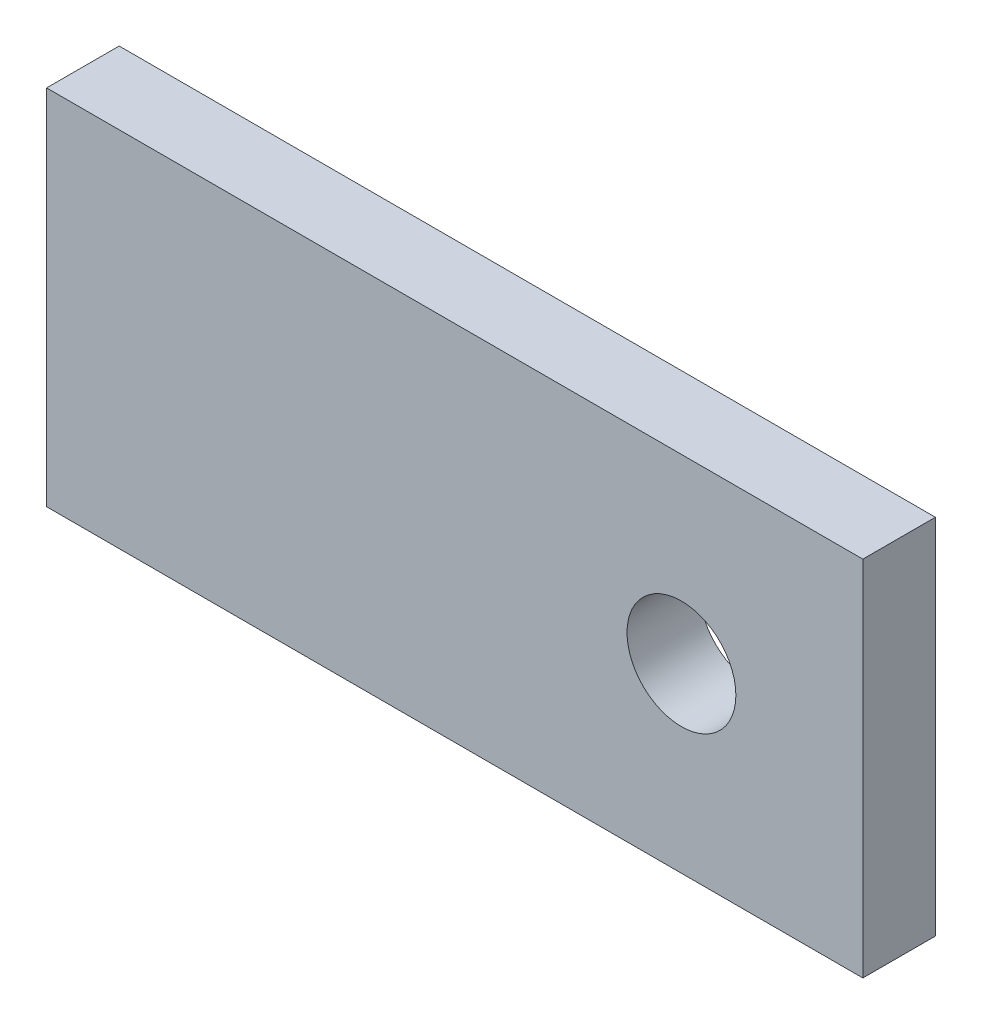
from build123d import *

# Parameters (mm, degrees)
SKETCH1_W           = 90
SKETCH1_H           = 40
SKETCH1_R           = 6
BOSS_EXTRUDE1_DEPTH = 8


with BuildPart() as part:
    # Sketch1 → Boss-Extrude1 (new body)
    with BuildSketch(Plane.XY):
        with Locations((-4.591836735, -8.06122449)):
            Rectangle(SKETCH1_W, SKETCH1_H)
        with Locations((20.408163265, -8.06122449)):
            Circle(SKETCH1_R, mode=Mode.SUBTRACT)
    extrude(amount=BOSS_EXTRUDE1_DEPTH)


solid = part.part
